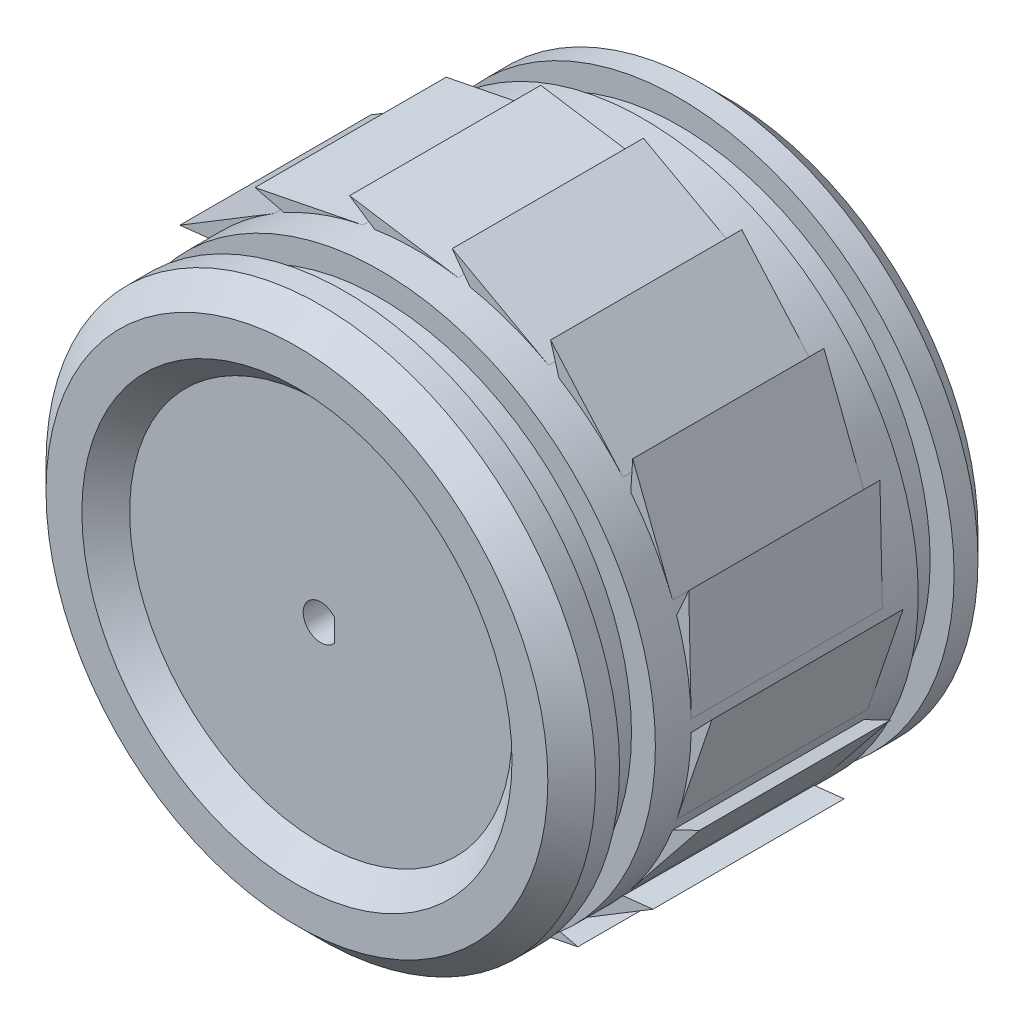
from build123d import *

# Parameters (mm, degrees)
CUT_EXTRUDE_1_DEPTH = 48.053161424
EXTRUDE_1_DEPTH     = 8


with BuildPart() as part:
    # Эскиз1 → Повернуть1 (revolve)
    with BuildSketch(Plane(origin=(0, 0, 0), x_dir=(0, 0, -1), z_dir=(1, 0, 0))):
        with BuildLine():
            Line((16, 23), (0, 23))
            Line((0, 23), (-16, 23))
            Line((-16, 23), (-18, 21))
            Line((-18, 21), (-18, 18))
            Line((-18, 18), (-16, 16))
            Line((-16, 16), (-16, 0))
            Line((-16, 0), (-14.334262465, 0))
            Line((-14.334262465, 0), (-6, 0))
            Line((-6, 0), (-6, 4))
            add(Edge.make_bspline(
                [(-12, 10), (-11.486384316, 10), (-7.521156143, 9.156929615), (-6, 5.021272174), (-6, 4)],
                knots=[0, 0, 0, 0, 0.351628705, 1, 1, 1, 1], degree=3))
            Line((-12, 10), (-12, 13.5))
            Line((-12, 13.5), (-8, 17.5))
            Line((-8, 17.5), (18, 17.5))
            Line((18, 17.5), (18, 21))
            Line((18, 21), (16, 23))
        make_face()
    revolve(axis=Axis((0, 0, 28.673920663), (0, 0, -1)))

    # Эскиз2 → Вырез-Вытянуть1 (cut, through all)
    with BuildSketch(Plane.XY.offset(16)):
        with BuildLine():
            Line((1.125, -0.953939201), (1.125, 0.953939201))
            ThreePointArc((1.125, 0.953939201), (-1.475, 0), (1.125, -0.953939201))
        make_face()
    extrude(amount=-CUT_EXTRUDE_1_DEPTH, mode=Mode.SUBTRACT)

    # Эскиз3 → Вырез-Повернуть1 (revolve, cut)
    with BuildSketch(Plane(origin=(0, 0, 0), x_dir=(0, 0, -1), z_dir=(1, 0, 0))):
        Polygon((18, 21), (16, 23), (14, 23), (14, 21), (11, 21), (11, 23), (-11, 23), (-11, 21), (-14, 21), (-14, 23), (-16, 23), (-18, 21), (-18, 24.334722486), (18, 24.334722486), align=None)
    revolve(axis=Axis((0, 0, 27.637589676), (0, 0, -1)), mode=Mode.SUBTRACT)

    # Эскиз4 → Бобышка-Вытянуть1 (add, symmetric)
    with BuildSketch(Plane.XY):
        with BuildLine():
            Line((-3.5, 22.732135843), (-5.592854337, 24.132135843))
            Line((-5.592854337, 24.132135843), (3.5, 22.732135843))
            ThreePointArc((3.5, 22.732135843), (0, 23), (-3.5, 22.732135843))
        make_face()
        with BuildLine():
            Line((2.99811261, 24.589658818), (11.063772532, 20.164149805))
            ThreePointArc((11.063772532, 20.164149805), (7.866463296, 21.612930278), (4.485924186, 22.558290808))
            Line((4.485924186, 22.558290808), (2.99811261, 24.589658818))
        make_face()
        with BuildLine():
            Line((11.227462929, 22.081306034), (17.293090813, 15.164069709))
            ThreePointArc((17.293090813, 15.164069709), (14.784115023, 17.619022192), (11.930779711, 19.663582977))
            Line((11.930779711, 19.663582977), (11.227462929, 22.081306034))
        make_face()
        with BuildLine():
            Line((18.102615519, 16.909621857), (21.436607123, 8.334979008))
            ThreePointArc((21.436607123, 8.334979008), (19.918584287, 11.5), (17.936607123, 14.397156835))
            Line((17.936607123, 14.397156835), (18.102615519, 16.909621857))
        make_face()
        with BuildLine():
            Line((22.794325512, 9.698387725), (22.994552243, 0.500566828))
            ThreePointArc((22.994552243, 0.500566828), (22.650578319, 3.993908086), (21.779014999, 7.394221099))
            Line((21.779014999, 7.394221099), (22.794325512, 9.698387725))
        make_face()
        with BuildLine():
            Line((24.736703439, 1.3173849), (21.779014999, -7.394221099))
            ThreePointArc((21.779014999, -7.394221099), (22.650578319, -3.993908086), (22.994552243, -0.500566828))
            Line((22.994552243, -0.500566828), (24.736703439, 1.3173849))
        make_face()
        with BuildLine():
            Line((23.695469857, -7.222513986), (17.936607123, -14.397156835))
            ThreePointArc((17.936607123, -14.397156835), (19.918584287, -11.5), (21.436607123, -8.334979008))
            Line((21.436607123, -8.334979008), (23.695469857, -7.222513986))
        make_face()
        with BuildLine():
            Line((19.796212902, -14.891271093), (11.930779711, -19.663582977))
            ThreePointArc((11.930779711, -19.663582977), (14.784115023, -17.619022192), (17.293090813, -15.164069709))
            Line((17.293090813, -15.164069709), (19.796212902, -14.891271093))
        make_face()
        with BuildLine():
            Line((13.50924051, -20.763921134), (4.485924186, -22.558290808))
            ThreePointArc((4.485924186, -22.558290808), (7.866463296, -21.612930278), (11.063772532, -20.164149805))
            Line((11.063772532, -20.164149805), (13.50924051, -20.763921134))
        make_face()
        with BuildLine():
            Line((5.592854337, -24.132135843), (-3.5, -22.732135843))
            ThreePointArc((-3.5, -22.732135843), (0, -23), (3.5, -22.732135843))
            Line((3.5, -22.732135843), (5.592854337, -24.132135843))
        make_face()
        with BuildLine():
            Line((-2.99811261, -24.589658818), (-11.063772532, -20.164149805))
            ThreePointArc((-11.063772532, -20.164149805), (-7.866463296, -21.612930278), (-4.485924186, -22.558290808))
            Line((-4.485924186, -22.558290808), (-2.99811261, -24.589658818))
        make_face()
        with BuildLine():
            Line((-11.227462929, -22.081306034), (-17.293090813, -15.164069709))
            ThreePointArc((-17.293090813, -15.164069709), (-14.784115023, -17.619022192), (-11.930779711, -19.663582977))
            Line((-11.930779711, -19.663582977), (-11.227462929, -22.081306034))
        make_face()
        with BuildLine():
            Line((-18.102615519, -16.909621857), (-21.436607123, -8.334979008))
            ThreePointArc((-21.436607123, -8.334979008), (-19.918584287, -11.5), (-17.936607123, -14.397156835))
            Line((-17.936607123, -14.397156835), (-18.102615519, -16.909621857))
        make_face()
        with BuildLine():
            Line((-22.794325512, -9.698387725), (-22.994552243, -0.500566828))
            ThreePointArc((-22.994552243, -0.500566828), (-22.650578319, -3.993908086), (-21.779014999, -7.394221099))
            Line((-21.779014999, -7.394221099), (-22.794325512, -9.698387725))
        make_face()
        with BuildLine():
            Line((-24.736703439, -1.3173849), (-21.779014999, 7.394221099))
            ThreePointArc((-21.779014999, 7.394221099), (-22.650578319, 3.993908086), (-22.994552243, 0.500566828))
            Line((-22.994552243, 0.500566828), (-24.736703439, -1.3173849))
        make_face()
        with BuildLine():
            Line((-23.695469857, 7.222513986), (-17.936607123, 14.397156835))
            ThreePointArc((-17.936607123, 14.397156835), (-19.918584287, 11.5), (-21.436607123, 8.334979008))
            Line((-21.436607123, 8.334979008), (-23.695469857, 7.222513986))
        make_face()
        with BuildLine():
            Line((-19.796212902, 14.891271093), (-11.930779711, 19.663582977))
            ThreePointArc((-11.930779711, 19.663582977), (-14.784115023, 17.619022192), (-17.293090813, 15.164069709))
            Line((-17.293090813, 15.164069709), (-19.796212902, 14.891271093))
        make_face()
        with BuildLine():
            Line((-13.50924051, 20.763921134), (-4.485924186, 22.558290808))
            ThreePointArc((-4.485924186, 22.558290808), (-7.866463296, 21.612930278), (-11.063772532, 20.164149805))
            Line((-11.063772532, 20.164149805), (-13.50924051, 20.763921134))
        make_face()
    extrude(amount=EXTRUDE_1_DEPTH, both=True)


solid = part.part
